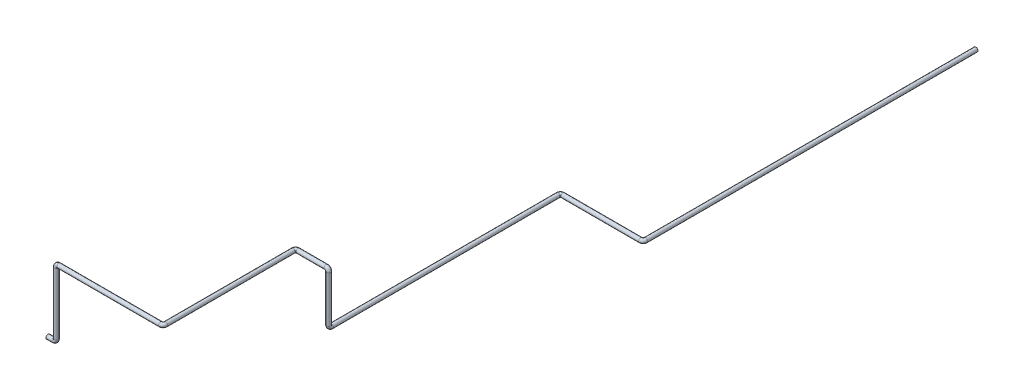
from build123d import *

# Parameters (mm, degrees)
CROQUIS1_R              = 12.7
SALIENTE_EXTRUIR1_DEPTH = 10
CROQUIS2_R              = 12.7
CROQUIS3_W              = 0.092547174
CROQUIS3_H              = 0.049722896
SALIENTE_EXTRUIR2_DEPTH = 1


with BuildPart() as part:
    # Croquis1 → Saliente-Extruir1 (new body)
    with BuildSketch(Plane.XY):
        Circle(CROQUIS1_R)
    extrude(amount=SALIENTE_EXTRUIR1_DEPTH)

    # Barrer1: sweep along a curve in space
    with BuildLine() as barrer1_path:
        Line((0, 0, 10), (0, 0, 1995))
        ThreePointArc((0, 0, 1995), (-4.393398282, 0, 2005.606601718), (-15, 0, 2010))
        Line((-15, 0, 2010), (-485, 0, 2010))
        ThreePointArc((-485, 0, 2010), (-495.606601718, 0, 2014.393398282), (-500, 0, 2025))
        Line((-500, 0, 2025), (-500, 0, 3395))
        ThreePointArc((-500, 0, 3395), (-500, 4.393398282, 3405.606601718), (-500, 15, 3410))
        Line((-500, 15, 3410), (-500, 295, 3410))
        ThreePointArc((-500, 295, 3410), (-504.393398282, 305.606601718, 3410), (-515, 310, 3410))
        Line((-515, 310, 3410), (-685, 310, 3410))
        ThreePointArc((-685, 310, 3410), (-695.606601718, 310, 3414.393398282), (-700, 310, 3425))
        Line((-700, 310, 3425), (-700, 310, 4195))
        ThreePointArc((-700, 310, 4195), (-704.393398282, 310, 4205.606601718), (-715, 310, 4210))
        Line((-715, 310, 4210), (-1330, 310, 4210))
        ThreePointArc((-1330, 310, 4210), (-1340.606601718, 305.606601718, 4210), (-1345, 295, 4210))
        Line((-1345, 295, 4210), (-1345, -80, 4210))
        ThreePointArc((-1345, -80, 4210), (-1349.393398282, -90.606601718, 4210), (-1360, -95, 4210))
        Line((-1360, -95, 4210), (-1395, -95, 4210))
    # Croquis2 → Barrer1 (sweep)
    with BuildSketch(Plane.XY.offset(10)):
        Circle(CROQUIS2_R)
    sweep(path=barrer1_path.line)

    # Croquis3 → Saliente-Extruir2 (add)
    with BuildSketch(Plane(origin=(0, 0, 0), x_dir=(-1, 0, 0), z_dir=(0, 0, -1))):
        with Locations((0, 12.7)):
            Rectangle(CROQUIS3_W, CROQUIS3_H)
    extrude(amount=-SALIENTE_EXTRUIR2_DEPTH)


solid = part.part
